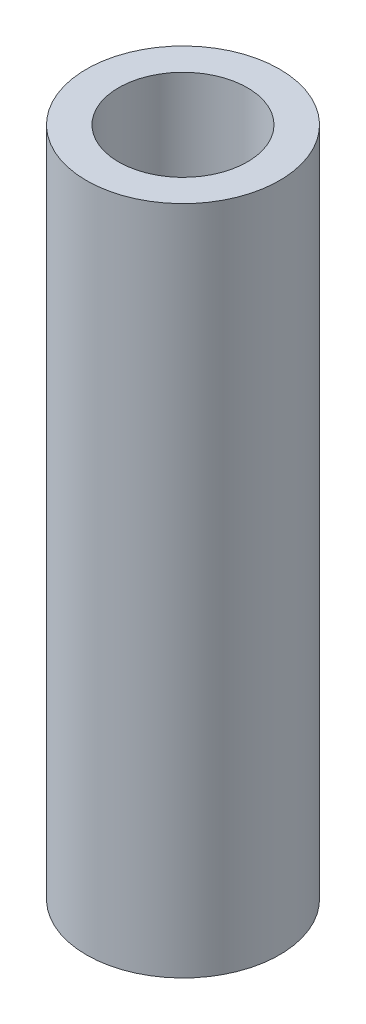
from build123d import *

# Parameters (mm, degrees)
SKETCH1_R           = 6
SKETCH1_R_2         = 4
BOSS_EXTRUDE1_DEPTH = 41.67


with BuildPart() as part:
    # Sketch1 → Boss-Extrude1 (new body)
    with BuildSketch(Plane(origin=(0, 0, 0), x_dir=(1, 0, 0), z_dir=(0, 1, 0))):
        with Locations(Location((0, 0, 0), (0, 0, 270))):
            Circle(SKETCH1_R)
        with Locations(Location((0, 0, 0), (0, 0, 270))):
            Circle(SKETCH1_R_2, mode=Mode.SUBTRACT)
    extrude(amount=BOSS_EXTRUDE1_DEPTH)


solid = part.part
